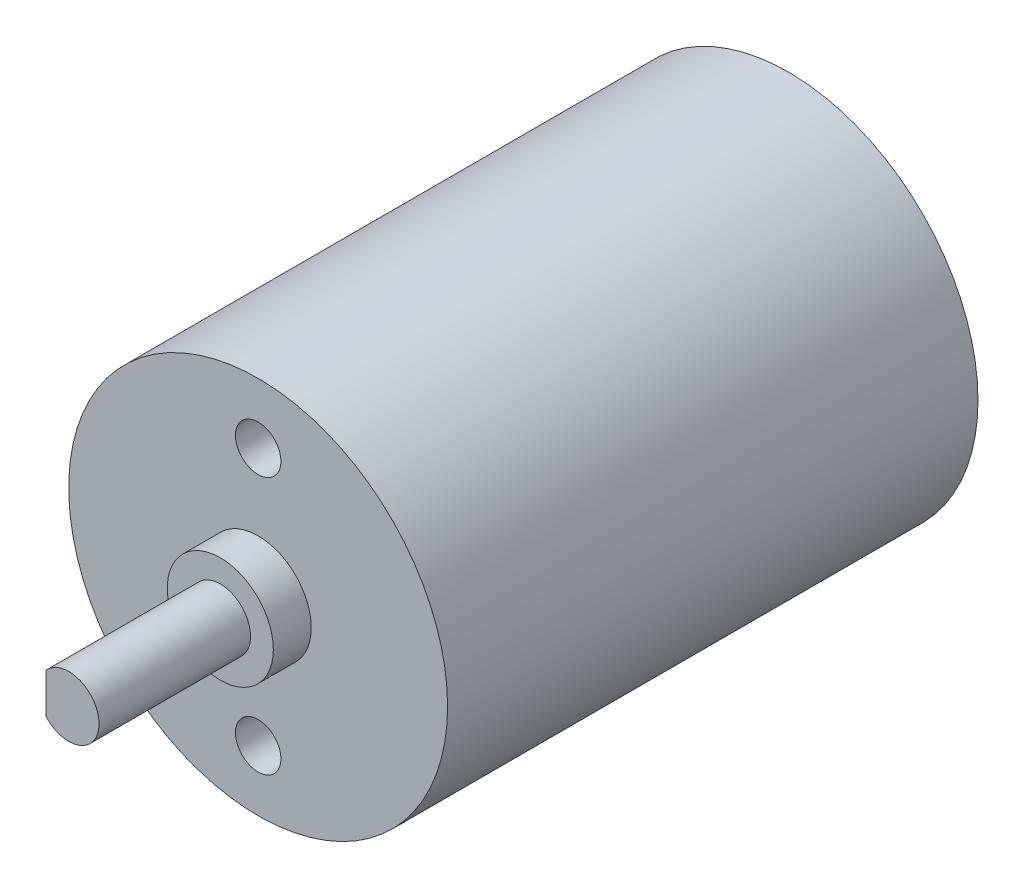
from build123d import *

# Parameters (mm, degrees)
SKETCH_1_R          = 12.5
EXTRUDE_1_DEPTH     = 35
SKETCH_2_R          = 3.5
EXTRUDE_2_DEPTH     = 2.5
SKETCH_3_R          = 2
EXTRUDE_3_DEPTH     = 10
CUT_EXTRUDE_START   = -10
CUT_EXTRUDE_1_DEPTH = 10
SKETCH_5_R          = 1.5
CUT_EXTRUDE_2_DEPTH = 4.5


with BuildPart() as part:
    # 草图1 → 凸台-拉伸1 (new body)
    with BuildSketch(Plane.XY):
        Circle(SKETCH_1_R)
    extrude(amount=EXTRUDE_1_DEPTH)

    # 草图2 → 凸台-拉伸2 (add)
    with BuildSketch(Plane.XY.offset(35)):
        Circle(SKETCH_2_R)
    extrude(amount=EXTRUDE_2_DEPTH)

    # 草图3 → 凸台-拉伸3 (add)
    with BuildSketch(Plane.XY.offset(37.5)):
        Circle(SKETCH_3_R)
    extrude(amount=EXTRUDE_3_DEPTH)

    # 草图4 → 切除-拉伸1 (cut)
    with BuildSketch(Plane.XY.offset(47.5).offset(CUT_EXTRUDE_START)):
        with BuildLine():
            Line((-1.5, 1.322875656), (-1.5, -1.322875656))
            ThreePointArc((-1.5, -1.322875656), (-2, 0), (-1.5, 1.322875656))
        make_face()
    extrude(amount=CUT_EXTRUDE_1_DEPTH, mode=Mode.SUBTRACT)

    # 草图5 → 切除-拉伸2 (cut)
    with BuildSketch(Plane.XY.offset(35)):
        with Locations((0, 8.5)):
            Circle(SKETCH_5_R)
        with Locations((0, -8.5)):
            Circle(SKETCH_5_R)
    extrude(amount=-CUT_EXTRUDE_2_DEPTH, mode=Mode.SUBTRACT)


solid = part.part
